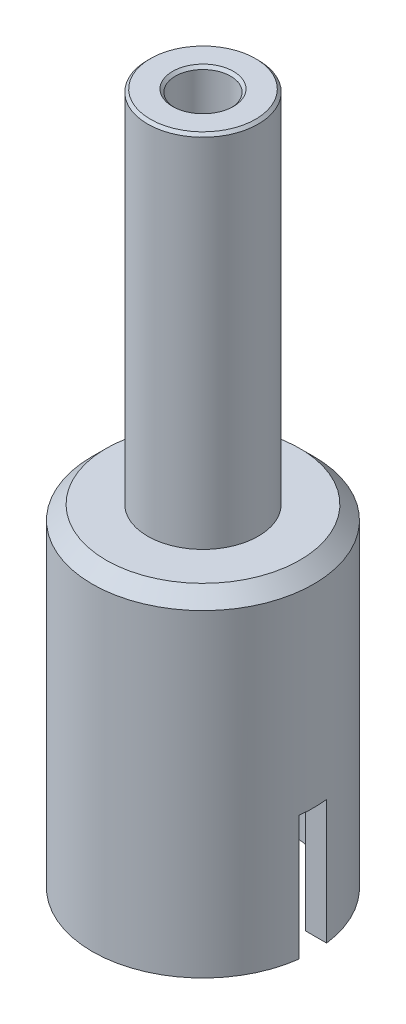
from build123d import *

# Parameters (mm, degrees)
SCHIZZO1_R        = 40
ESTRUSIONE1_DEPTH = 120
SCHIZZO2_R        = 32.5
ESTRUSIONE2_DEPTH = 110
SMUSSO1_SIZE      = 5
SCHIZZO3_R        = 20
ESTRUSIONE3_DEPTH = 130
SCHIZZO4_R        = 10
ESTRUSIONE4_DEPTH = 257.32011236
SMUSSO2_SIZE      = 1
SCHIZZO5_W        = 88.337421072
SCHIZZO5_H        = 10
ESTRUSIONE5_DEPTH = 45


with BuildPart() as part:
    # Schizzo1 → Estrusione1 (new body)
    with BuildSketch(Plane(origin=(0, 0, 0), x_dir=(1, 0, 0), z_dir=(0, 1, 0))):
        with Locations(Location((0, 0, 0), (0, 0, 90))):
            Circle(SCHIZZO1_R)
    extrude(amount=ESTRUSIONE1_DEPTH)

    # Schizzo2 → Estrusione2 (cut)
    with BuildSketch(Plane.XZ):
        with Locations(Location((0, 0, 0), (0, 0, 270))):
            Circle(SCHIZZO2_R)
    extrude(amount=-ESTRUSIONE2_DEPTH, mode=Mode.SUBTRACT)

    # Smusso1
    smusso1_edges = [part.edges().sort_by_distance(p)[0] for p in [
        (0, 120, 40),
    ]]
    chamfer(smusso1_edges, length=SMUSSO1_SIZE)

    # Schizzo3 → Estrusione3 (add)
    with BuildSketch(Plane(origin=(0, 120, 0), x_dir=(1, 0, 0), z_dir=(0, 1, 0))):
        with Locations(Location((0, 0, 0), (0, 0, 270))):
            Circle(SCHIZZO3_R)
    extrude(amount=ESTRUSIONE3_DEPTH)

    # Schizzo4 → Estrusione4 (cut, through all)
    with BuildSketch(Plane(origin=(0, 250, 0), x_dir=(1, 0, 0), z_dir=(0, 1, 0))):
        with Locations(Location((0, 0, 0), (0, 0, 270))):
            Circle(SCHIZZO4_R)
    extrude(amount=-ESTRUSIONE4_DEPTH, mode=Mode.SUBTRACT)

    # Smusso2
    smusso2_edges = [part.edges().sort_by_distance(p)[0] for p in [
        (0, 250, -20),
        (0, 250, -10),
    ]]
    chamfer(smusso2_edges, length=SMUSSO2_SIZE)

    # Schizzo5 → Estrusione5 (cut)
    with BuildSketch(Plane.XZ):
        Rectangle(SCHIZZO5_W, SCHIZZO5_H)
    extrude(amount=-ESTRUSIONE5_DEPTH, mode=Mode.SUBTRACT)


solid = part.part
